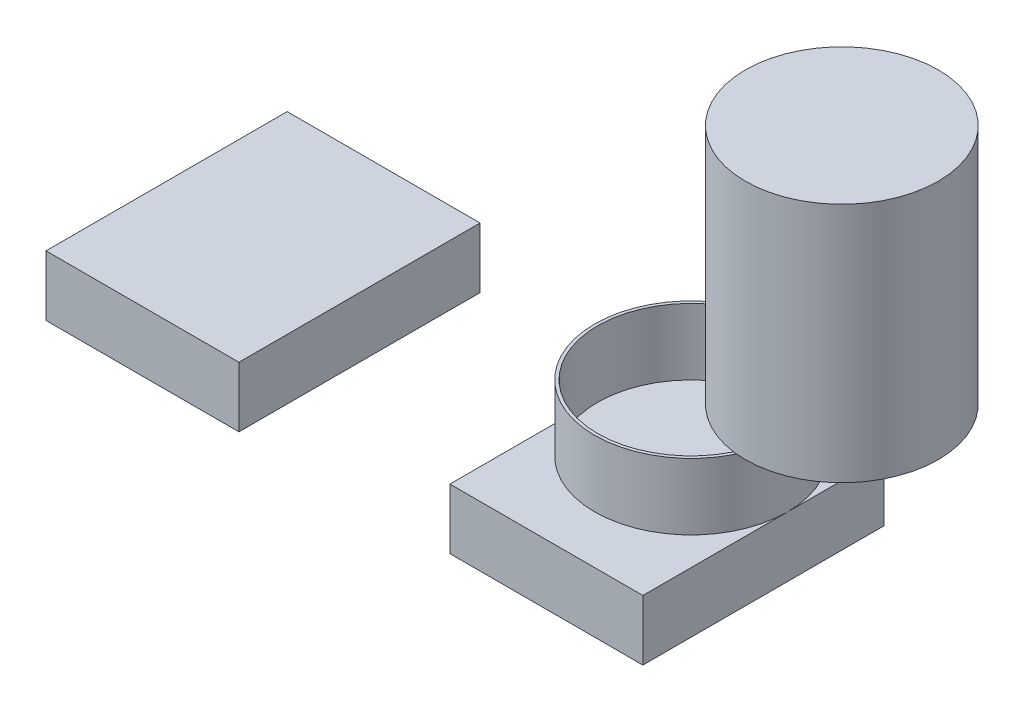
from build123d import *

# Parameters (mm, degrees)
SKETCH2_W             = 320
SKETCH2_H             = 400
BOSS_EXTRUDE1_DEPTH   = 100
BOSS_EXTRUDE1_2_DEPTH = 100
SKETCH4_R             = 160
SKETCH4_R_2           = 155
BOSS_EXTRUDE3_DEPTH   = 110
SKETCH5_R             = 160
BOSS_EXTRUDE4_DEPTH   = 400


with BuildPart() as part:
    # Sketch2 → Boss-Extrude1 (new body)
    with BuildSketch(Plane(origin=(0, 0, 0), x_dir=(1, 0, 0), z_dir=(0, 1, 0))):
        with Locations((-670, -40)):
            Rectangle(SKETCH2_W, SKETCH2_H)
    extrude(amount=BOSS_EXTRUDE1_DEPTH)


with BuildPart() as body_2:
    # Sketch2 → Boss-Extrude1 2 (new body)
    with BuildSketch(Plane(origin=(0, 0, 0), x_dir=(1, 0, 0), z_dir=(0, 1, 0))):
        with Locations((0, -40)):
            Rectangle(SKETCH2_W, SKETCH2_H)
    extrude(amount=BOSS_EXTRUDE1_2_DEPTH)

    # Sketch4 → Boss-Extrude3 (add)
    with BuildSketch(Plane(origin=(0, 100, 0), x_dir=(1, 0, 0), z_dir=(0, 1, 0))):
        with Locations(Location((0, 0, 0), (0, 0, 90))):
            Circle(SKETCH4_R)
        with Locations(Location((0, 0, 0), (0, 0, 270))):
            Circle(SKETCH4_R_2, mode=Mode.SUBTRACT)
    extrude(amount=BOSS_EXTRUDE3_DEPTH)


with BuildPart() as body_3:
    # Sketch5 → Boss-Extrude4 (new body)
    with BuildSketch(Plane(origin=(0, 300, 0), x_dir=(1, 0, 0), z_dir=(0, 1, 0))):
        with Locations(Location((250, 0, 0), (0, 0, 270))):
            Circle(SKETCH5_R)
    extrude(amount=BOSS_EXTRUDE4_DEPTH)


solid = Compound([part.part, body_2.part, body_3.part])
